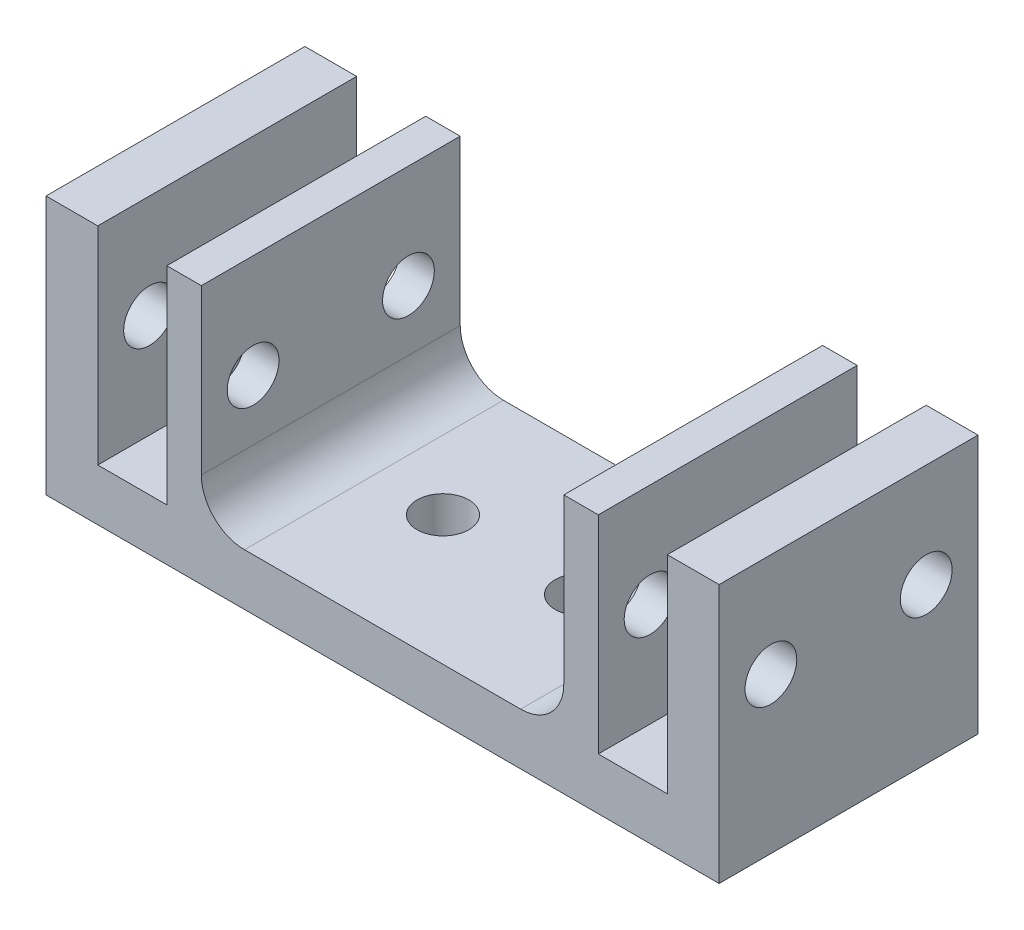
from build123d import *

# Parameters (mm, degrees)
EXTRUDE_1_DEPTH     = 15
SKETCH_2_R          = 1.5
CUT_EXTRUDE_1_DEPTH = 15
SKETCH_3_R          = 1.5
CUT_EXTRUDE_2_DEPTH = 45.395945761
FILLET_1_R          = 2.5


with BuildPart() as part:
    # 草图1 → 凸台-拉伸1 (new body)
    with BuildSketch(Plane.XY):
        Polygon((19.5, 0), (-19.5, 0), (-19.5, 15), (-16.5, 15), (-16.5, 3), (-12.5, 3), (-12.5, 15), (-10.5, 15), (-10.5, 3), (10.5, 3), (10.5, 15), (12.5, 15), (12.5, 3), (16.5, 3), (16.5, 15), (19.5, 15), align=None)
    extrude(amount=EXTRUDE_1_DEPTH)

    # 草图2 → 切除-拉伸1 (cut)
    with BuildSketch(Plane(origin=(0, 3, 0), x_dir=(1, 0, 0), z_dir=(0, 1, 0))):
        with Locations(Location((-4, -7.5, 0), (0, 0, 270))):
            Circle(SKETCH_2_R)
        with Locations(Location((4, -7.5, 0), (0, 0, 270))):
            Circle(SKETCH_2_R)
    extrude(amount=-CUT_EXTRUDE_1_DEPTH, mode=Mode.SUBTRACT)

    # 草图3 → 切除-拉伸2 (cut, through all)
    with BuildSketch(Plane(origin=(19.5, 0, 0), x_dir=(0, 0, -1), z_dir=(1, 0, 0))):
        with Locations(Location((-12, 9, 0), (0, 0, 90))):
            Circle(SKETCH_3_R)
        with Locations(Location((-3, 9, 0), (0, 0, 270))):
            Circle(SKETCH_3_R)
    extrude(amount=-CUT_EXTRUDE_2_DEPTH, mode=Mode.SUBTRACT)

    # 圆角1
    fillet_1_edges = [part.edges().sort_by_distance(p)[0] for p in [
        (-10.5, 3, 7.5),
        (10.5, 3, 7.5),
    ]]
    fillet(fillet_1_edges, radius=FILLET_1_R)


solid = part.part
